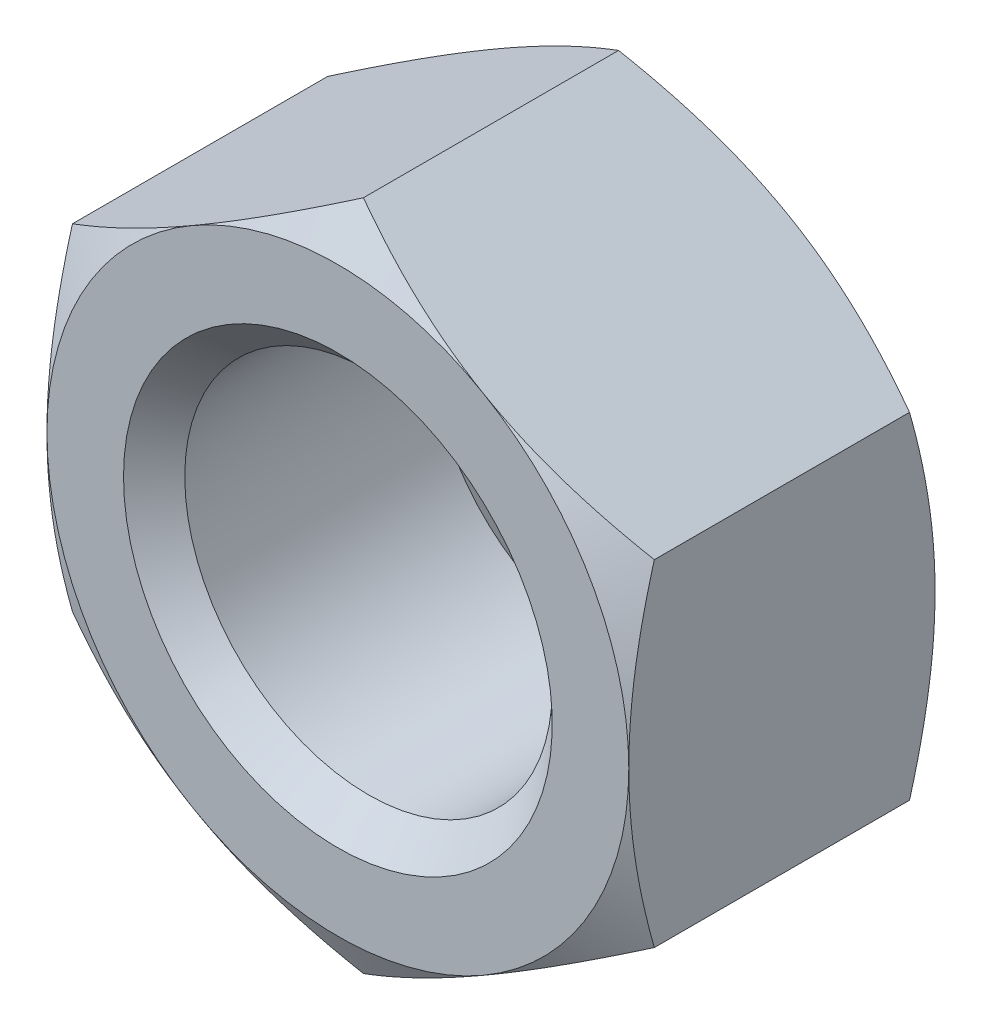
from build123d import *

# Parameters (mm, degrees)
SKETCH1_R           = 6
BOSS_EXTRUDE1_DEPTH = 10


with BuildPart() as part:
    # Sketch1 → Boss-Extrude1 (new body)
    with BuildSketch(Plane.XY):
        Polygon((0, -10.969655115), (9.5, -5.484827557), (9.5, 5.484827557), (0, 10.969655115), (-9.5, 5.484827557), (-9.5, -5.484827557), align=None)
        Circle(SKETCH1_R, mode=Mode.SUBTRACT)
    extrude(amount=BOSS_EXTRUDE1_DEPTH)

    # Sketch2 → Cut-Revolve1 (revolve, cut)
    with BuildSketch(Plane(origin=(0, 0, 0), x_dir=(0, 0, -1), z_dir=(1, 0, 0)), mode=Mode.PRIVATE) as cut_revolve1_sk:
        Polygon((-10, 10.969655115), (-10, 9.5), (-9.166666667, 10.969655115), align=None)
        Polygon((-0.833333333, 10.969655115), (0, 10.969655115), (0, 9.5), align=None)
        Polygon((-10, 6), (-9, 6), (-10, 7), align=None)
        Polygon((0, 6), (-1, 6), (0, 7), align=None)
    revolve(cut_revolve1_sk.sketch.rotate(Axis((0, 0, 0), (0, 0, 1)), 90), axis=Axis((0, 0, 0), (0, 0, 1)), mode=Mode.SUBTRACT)


solid = part.part
